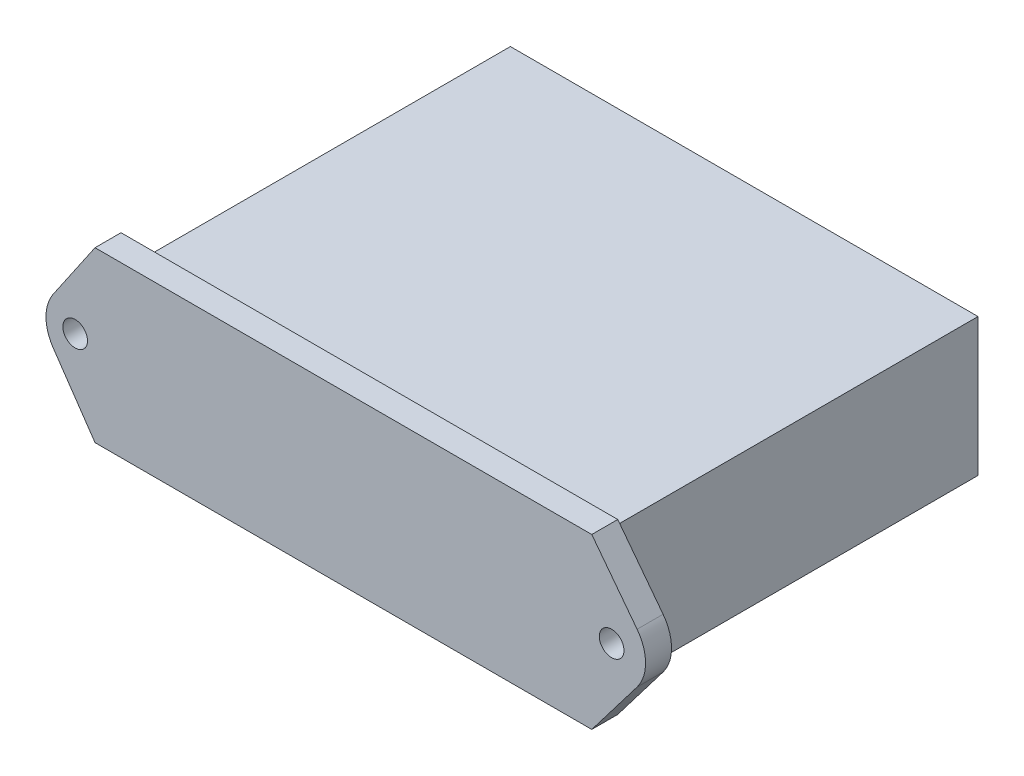
from build123d import *

# Parameters (mm, degrees)
SKETCH1_W           = 72
SKETCH1_H           = 57.2
BOSS_EXTRUDE1_DEPTH = 21.2
BOSS_EXTRUDE2_DEPTH = 4
FILLET1_R           = 6.35
SKETCH3_R           = 1.9
CUT_EXTRUDE1_DEPTH  = 106.016516715


with BuildPart() as part:
    # Sketch1 → Boss-Extrude1 (new body)
    with BuildSketch(Plane(origin=(0, 0, 0), x_dir=(1, 0, 0), z_dir=(0, 1, 0))):
        with Locations((36, 28.6)):
            Rectangle(SKETCH1_W, SKETCH1_H)
    extrude(amount=BOSS_EXTRUDE1_DEPTH)

    # Sketch2 → Boss-Extrude2 (add)
    with BuildSketch(Plane.XY):
        Polygon((-2.753924381, 23.6), (73.730718456, 23.6), (83.65, 10.6), (73.730718456, -2.4), (-2.753924381, -2.4), (-11.65, 10.6), align=None)
    extrude(amount=BOSS_EXTRUDE2_DEPTH)

    # Fillet1
    fillet1_edges = [part.edges().sort_by_distance(p)[0] for p in [
        (-11.65, 10.6, 2),
        (83.65, 10.6, 2),
    ]]
    fillet(fillet1_edges, radius=FILLET1_R)

    # Sketch3 → Cut-Extrude1 (cut, through all)
    with BuildSketch(Plane.XY.offset(4)):
        with Locations((-5.811602962, 10.6)):
            Circle(SKETCH3_R)
        with Locations((76.788397038, 10.6)):
            Circle(SKETCH3_R)
    extrude(amount=-CUT_EXTRUDE1_DEPTH, mode=Mode.SUBTRACT)


solid = part.part
